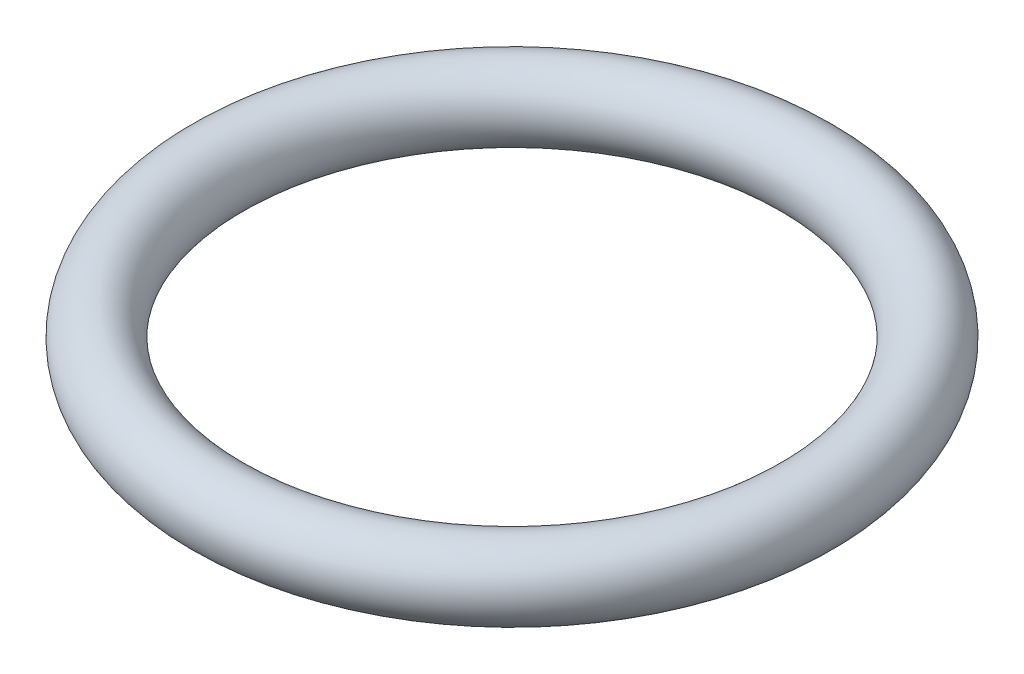
from build123d import *

# Parameters (mm, degrees)
SKETCH1_R = 0.85


with BuildPart() as part:
    # Sketch1 → Revolve1 (revolve)
    with BuildSketch(Plane.XY, mode=Mode.PRIVATE) as revolve1_sk:
        with Locations((-7, 0)):
            Circle(SKETCH1_R)
    revolve(revolve1_sk.sketch.rotate(Axis((0, -3.97209602, 0), (0, 1, 0)), 270), axis=Axis((0, -3.97209602, 0), (0, 1, 0)))


solid = part.part
